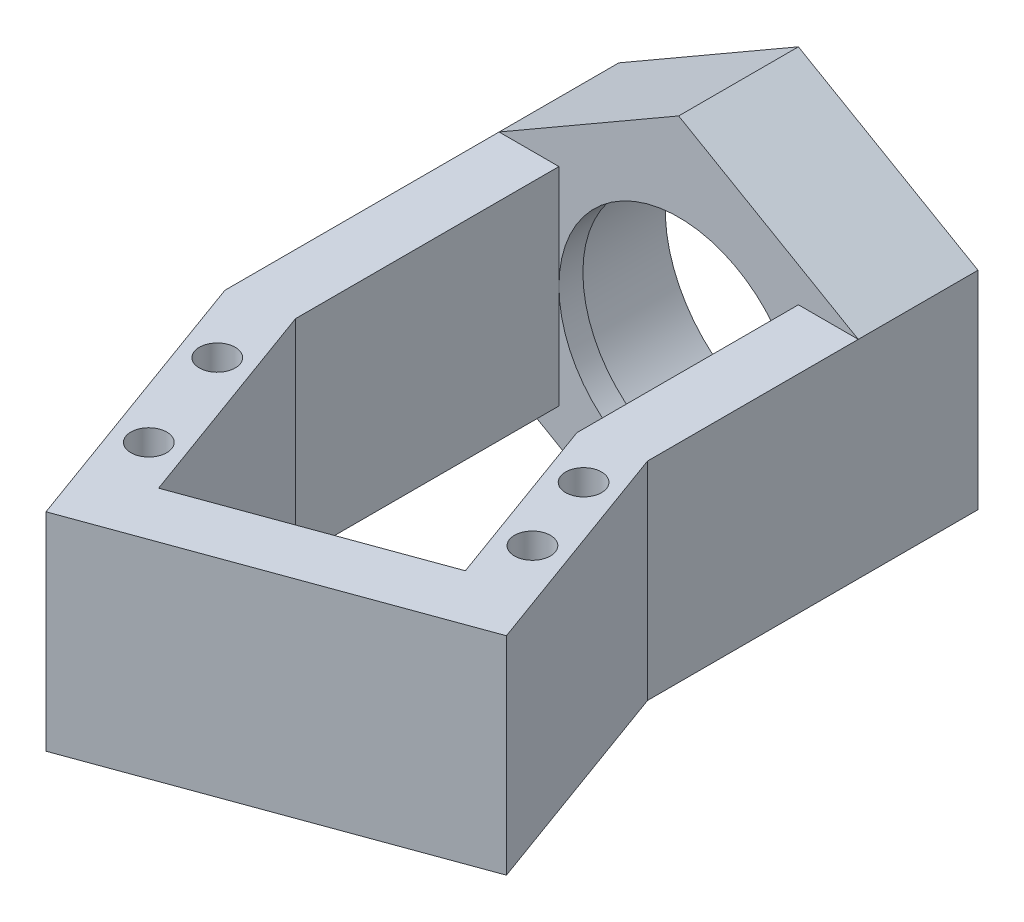
from build123d import *

# Parameters (mm, degrees)
SKETCH1_R                = 11.125
BOSS_EXTRUDE2_DEPTH      = 8
SKETCH2_R                = 10
BOSS_EXTRUDE3_DEPTH      = 2
BOSS_EXTRUDE6_DEPTH      = 8.66
BOSS_EXTRUDE6_DEPTH_BACK = 8.660254
CUT_EXTRUDE2_DEPTH       = 62.226087838
CUT_EXTRUDE2_DEPTH_BACK  = 62.226087838
SKETCH8_R                = 1.5
SKETCH9_W                = 30.003485383
SKETCH9_H                = 17.320254038
BOSS_EXTRUDE7_DEPTH      = 5


with BuildPart() as part:
    # Sketch1 → Boss-Extrude2 (new body)
    with BuildSketch(Plane.XY):
        Polygon((0, 17.320508076), (-15, 8.660254038), (-15, -8.660254038), (0, -17.320508076), (15, -8.660254038), (15, 8.660254038), align=None)
        Circle(SKETCH1_R, mode=Mode.SUBTRACT)
    extrude(amount=BOSS_EXTRUDE2_DEPTH)

    # Sketch2 → Boss-Extrude3 (add)
    with BuildSketch(Plane.XY.offset(8)):
        Polygon((0, 17.320508076), (-15, 8.660254038), (-15, -8.660254038), (0, -17.320508076), (15, -8.660254038), (15, 8.660254038), align=None)
        Circle(SKETCH2_R, mode=Mode.SUBTRACT)
    extrude(amount=BOSS_EXTRUDE3_DEPTH)

    # Sketch6 → Boss-Extrude6 (add, two sides: drawn at the far end of the back side and taken through both)
    with BuildSketch(Plane(origin=(0, 0, 0), x_dir=(1, 0, 0), z_dir=(0, 1, 0)).offset(-BOSS_EXTRUDE6_DEPTH_BACK)):
        Polygon((15, -10), (15, -27.6), (20.034456679, -41.432056045), (15.330091147, -43.144305069), (10, -28.5), (10, -10), align=None)
        Polygon((-15, -10), (-15, -32.9), (-8.159597133, -51.693852416), (-3.455231601, -49.981603391), (-10, -32), (-10, -10), align=None)
    extrude(amount=BOSS_EXTRUDE6_DEPTH + BOSS_EXTRUDE6_DEPTH_BACK)

    # Sketch8 → Cut-Extrude2 (cut, two sides: drawn at the far end of the back side and taken through both)
    with BuildSketch(Plane.XZ.offset(8.660254038).offset(-CUT_EXTRUDE2_DEPTH_BACK)):
        with Locations(Location((-10.44787914, 38.088155725, 0), (0, 0, 90))):
            Circle(SKETCH8_R)
        with Locations(Location((-7.175494941, 47.07895742, 0), (0, 0, 90))):
            Circle(SKETCH8_R)
        with Locations(Location((16.31419334, 38.529410074, 0), (0, 0, 270))):
            Circle(SKETCH8_R)
        with Locations(Location((13.868080573, 31.808770483, 0), (0, 0, 270))):
            Circle(SKETCH8_R)
    extrude(amount=CUT_EXTRUDE2_DEPTH + CUT_EXTRUDE2_DEPTH_BACK, mode=Mode.SUBTRACT)

    # Sketch9 → Boss-Extrude7 (add)
    with BuildSketch(Plane(origin=(15.659592369, 0, 43.024376432), x_dir=(0.9396926207859078, 0, -0.3420201433256706), z_dir=(0.3420201433256706, 0, 0.9396926207859078))):
        with Locations((-10.346109336, -0.000127019)):
            Rectangle(SKETCH9_W, SKETCH9_H)
    extrude(amount=BOSS_EXTRUDE7_DEPTH)


solid = part.part
